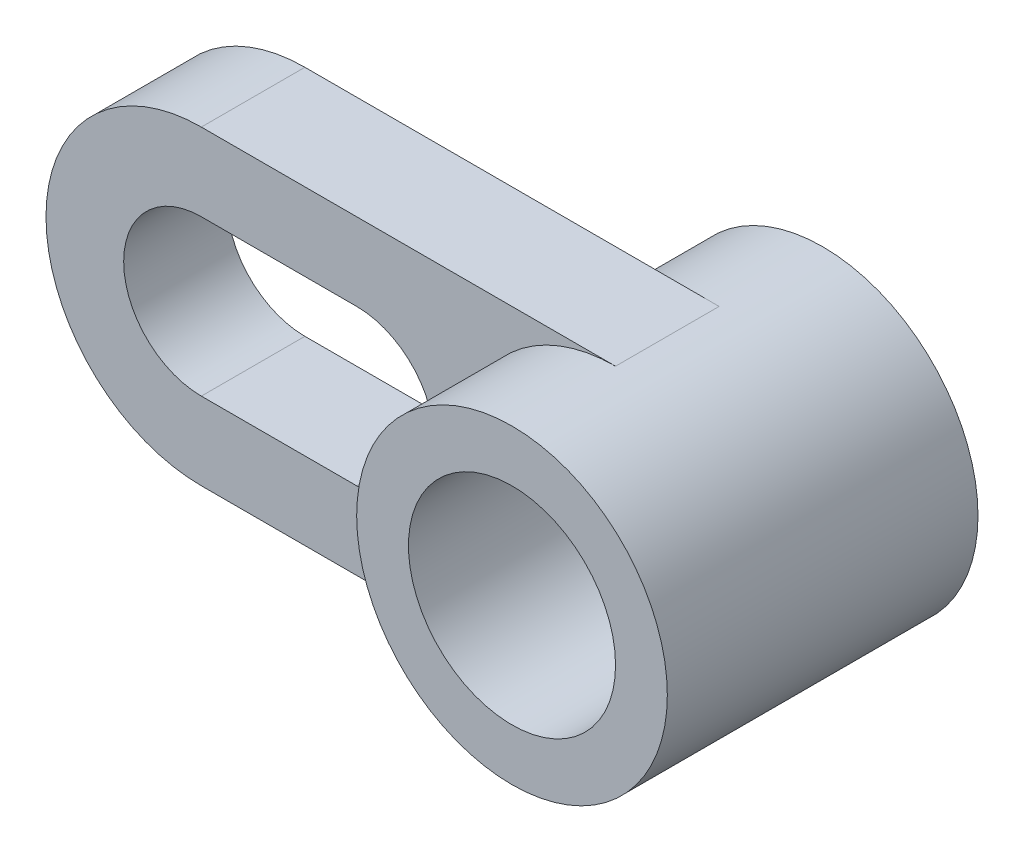
from build123d import *

# Parameters (mm, degrees)
SKETCH1_R           = 15
SKETCH1_R_2         = 10
BOSS_EXTRUDE1_DEPTH = 30
BOSS_EXTRUDE2_DEPTH = 5


with BuildPart() as part:
    # Sketch1 → Boss-Extrude1 (new body)
    with BuildSketch(Plane.XY):
        Circle(SKETCH1_R)
        Circle(SKETCH1_R_2, mode=Mode.SUBTRACT)
    extrude(amount=-BOSS_EXTRUDE1_DEPTH)

    # Sketch2 → Boss-Extrude2 (add, symmetric)
    with BuildSketch(Plane.XY.offset(-15)):
        with BuildLine():
            Line((-40, 15), (0, 15))
            ThreePointArc((0, 15), (-15, 0), (0, -15))
            Line((0, -15), (-40, -15))
            ThreePointArc((-40, -15), (-55, 0), (-40, 15))
        make_face()
        with BuildLine():
            Line((-40, 7.5), (-25, 7.5))
            ThreePointArc((-25, 7.5), (-17.5, 0), (-25, -7.5))
            Line((-25, -7.5), (-40, -7.5))
            ThreePointArc((-40, -7.5), (-47.5, 0), (-40, 7.5))
        make_face(mode=Mode.SUBTRACT)
    extrude(amount=BOSS_EXTRUDE2_DEPTH, both=True)


solid = part.part
